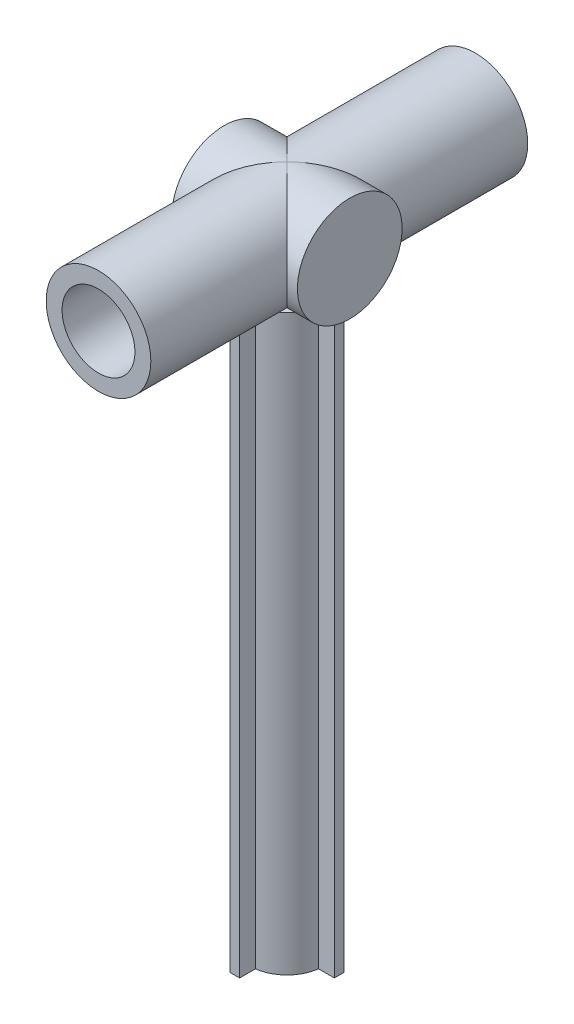
from build123d import *

# Parameters (mm, degrees)
BOSS_EXTRUDE2_DEPTH      = 69.596
SKETCH4_R                = 2.794
CUT_EXTRUDE1_DEPTH       = 71.16819064
BOSS_EXTRUDE3_DEPTH      = 22.86
BOSS_EXTRUDE3_DEPTH_BACK = 22.86
SKETCH5_R                = 6.35
SKETCH6_R                = 3.738220815
CUT_EXTRUDE3_DEPTH       = 12.7
BOSS_EXTRUDE4_DEPTH      = 7.62
BOSS_EXTRUDE4_DEPTH_BACK = 7.62
SKETCH7_R                = 6.35
SKETCH8_R                = 4.419485512
CUT_EXTRUDE4_DEPTH       = 10.16
SKETCH9_R                = 4.419485573
CUT_EXTRUDE5_DEPTH       = 10.16


with BuildPart() as part:
    # Sketch3 → Boss-Extrude2 (new body)
    with BuildSketch(Plane(origin=(0, 0, 0), x_dir=(1, 0, 0), z_dir=(0, 1, 0))):
        with BuildLine():
            Line((-0.580188924, 4.406972409), (-0.580188924, 6.323439002))
            Line((-0.580188924, 6.323439002), (0.580188924, 6.323439002))
            Line((0.580188924, 6.323439002), (0.580188924, 4.406972409))
            ThreePointArc((0.580188924, 4.406972409), (3.143089642, 3.143089642), (4.406972409, 0.580188924))
            Line((4.406972409, 0.580188924), (6.323439002, 0.580188924))
            Line((6.323439002, 0.580188924), (6.323439002, -0.580188924))
            Line((6.323439002, -0.580188924), (4.406972409, -0.580188924))
            ThreePointArc((4.406972409, -0.580188924), (3.143089642, -3.143089642), (0.580188924, -4.406972409))
            Line((0.580188924, -4.406972409), (0.580188924, -6.323439002))
            Line((0.580188924, -6.323439002), (-0.580188924, -6.323439002))
            Line((-0.580188924, -6.323439002), (-0.580188924, -4.406972409))
            ThreePointArc((-0.580188924, -4.406972409), (-3.143089642, -3.143089642), (-4.406972409, -0.580188924))
            Line((-4.406972409, -0.580188924), (-6.323439002, -0.580188924))
            Line((-6.323439002, -0.580188924), (-6.323439002, 0.580188924))
            Line((-6.323439002, 0.580188924), (-4.406972409, 0.580188924))
            ThreePointArc((-4.406972409, 0.580188924), (-3.143089642, 3.143089642), (-0.580188924, 4.406972409))
        make_face()
    extrude(amount=BOSS_EXTRUDE2_DEPTH)

    # Sketch4 → Cut-Extrude1 (cut, through all)
    with BuildSketch(Plane(origin=(0, 69.596, 0), x_dir=(1, 0, 0), z_dir=(0, 1, 0))):
        with Locations(Location((0, 0, 0), (0, 0, 270))):
            Circle(SKETCH4_R)
    extrude(amount=-CUT_EXTRUDE1_DEPTH, mode=Mode.SUBTRACT)


with BuildPart() as body_2:
    # Sketch5 → Boss-Extrude3 (new, two sides: drawn at the far end of the back side and taken through both)
    with BuildSketch(Plane.XY.offset(-BOSS_EXTRUDE3_DEPTH_BACK)):
        with Locations((0, 75.946)):
            Circle(SKETCH5_R)
    extrude(amount=BOSS_EXTRUDE3_DEPTH + BOSS_EXTRUDE3_DEPTH_BACK)


with BuildPart() as body_3:
    # Mirror1: mirrored copy
    add(body_2.part.mirror(Plane.XY))


with BuildPart() as cut_extrude3_tool:
    # Sketch6 → Cut-Extrude3 (new body)
    with BuildSketch(Plane.XY.offset(22.86)):
        with Locations((0, 75.946)):
            Circle(SKETCH6_R)
    extrude(amount=-CUT_EXTRUDE3_DEPTH)


with BuildPart() as body_2_1:
    add(body_2.part)

    # Cut-Extrude3: cut by cut_extrude3_tool
    add(cut_extrude3_tool.part, mode=Mode.SUBTRACT)


with BuildPart() as body_3_1:
    add(body_3.part)

    # Cut-Extrude3: cut by cut_extrude3_tool
    add(cut_extrude3_tool.part, mode=Mode.SUBTRACT)


with BuildPart() as body_4:
    # Mirror2: mirrored copy
    add(body_2_1.part.mirror(Plane.XY))


with BuildPart() as body_2_2:
    add(body_2_1.part)

    add(body_3_1.part)  # Boss-Extrude4 merges body 3

    add(body_4.part)  # Boss-Extrude4 merges body 4
    # Sketch7 → Boss-Extrude4 (add, two sides: drawn at the far end of the back side and taken through both)
    with BuildSketch(Plane(origin=(0, 0, 0), x_dir=(0, 0, -1), z_dir=(1, 0, 0)).offset(-BOSS_EXTRUDE4_DEPTH_BACK)):
        with Locations((0, 75.946)):
            Circle(SKETCH7_R)
    extrude(amount=BOSS_EXTRUDE4_DEPTH + BOSS_EXTRUDE4_DEPTH_BACK)

    # Sketch8 → Cut-Extrude4 (cut)
    with BuildSketch(Plane.XY.offset(22.86)):
        with Locations((0, 75.946)):
            Circle(SKETCH8_R)
    extrude(amount=-CUT_EXTRUDE4_DEPTH, mode=Mode.SUBTRACT)

    # Sketch9 → Cut-Extrude5 (cut)
    with BuildSketch(Plane(origin=(0, 0, -22.86), x_dir=(-1, 0, 0), z_dir=(0, 0, -1))):
        with Locations((0, 76.071629016)):
            Circle(SKETCH9_R)
    extrude(amount=-CUT_EXTRUDE5_DEPTH, mode=Mode.SUBTRACT)


solid = Compound([part.part, body_2_2.part])
